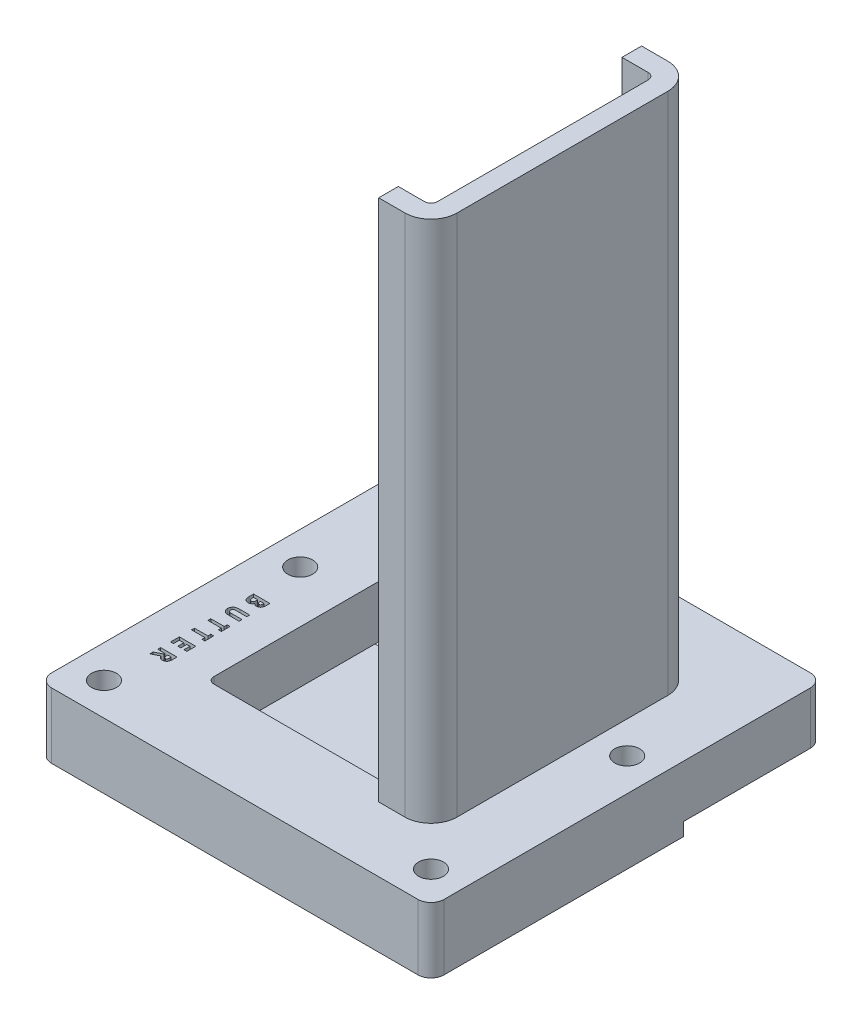
from build123d import *

# Parameters (mm, degrees)
SKETCH1_W           = 76.2
SKETCH1_H           = 76.2
BOSS_EXTRUDE1_DEPTH = 12.7
SKETCH2_W           = 43.434
SKETCH2_H           = 43.434
CUT_EXTRUDE1_DEPTH  = 10.16
FILLET1_R           = 1.27
CUT_EXTRUDE2_DEPTH  = 55.831064188
SKETCH4_R           = 2.413
CUT_EXTRUDE3_DEPTH  = 56.358016583
FILLET2_R           = 2.54
SKETCH5_W           = 76.2
SKETCH5_H           = 27.178
CUT_EXTRUDE4_DEPTH  = 2.54
BOSS_EXTRUDE2_DEPTH = 101.6
CUT_EXTRUDE5_DEPTH  = 1.27


with BuildPart() as part:
    # Sketch1 → Boss-Extrude1 (new body)
    with BuildSketch(Plane(origin=(0, 0, 0), x_dir=(1, 0, 0), z_dir=(0, 1, 0))):
        Rectangle(SKETCH1_W, SKETCH1_H)
    extrude(amount=BOSS_EXTRUDE1_DEPTH)

    # Sketch2 → Cut-Extrude1 (cut)
    with BuildSketch(Plane(origin=(0, 12.7, 0), x_dir=(1, 0, 0), z_dir=(0, 1, 0))):
        Rectangle(SKETCH2_W, SKETCH2_H)
    extrude(amount=-CUT_EXTRUDE1_DEPTH, mode=Mode.SUBTRACT)

    # Fillet1
    fillet1_edges = [part.edges().sort_by_distance(p)[0] for p in [
        (21.717, 7.62, -21.717),
        (21.717, 7.62, 21.717),
        (-21.717, 7.62, 21.717),
        (-21.717, 7.62, -21.717),
    ]]
    fillet(fillet1_edges, radius=FILLET1_R)

    # Sketch3 → Cut-Extrude2 (cut, through all)
    with BuildSketch(Plane(origin=(0, 2.54, 0), x_dir=(1, 0, 0), z_dir=(0, 1, 0))):
        with BuildLine():
            Line((-21.717, 10.8585), (21.717, 10.8585))
            Line((21.717, 10.8585), (21.717, 20.447))
            ThreePointArc((21.717, 20.447), (21.345025612, 21.345025612), (20.447, 21.717))
            Line((20.447, 21.717), (-20.447, 21.717))
            ThreePointArc((-20.447, 21.717), (-21.345025612, 21.345025612), (-21.717, 20.447))
            Line((-21.717, 20.447), (-21.717, 10.8585))
        make_face()
    extrude(amount=-CUT_EXTRUDE2_DEPTH, mode=Mode.SUBTRACT)

    # Sketch4 → Cut-Extrude3 (cut, through all)
    with BuildSketch(Plane(origin=(0, 12.7, 0), x_dir=(1, 0, 0), z_dir=(0, 1, 0))):
        with Locations(Location((31.75, -31.75, 0), (0, 0, 270))):
            Circle(SKETCH4_R)
        with Locations(Location((-31.75, -31.75, 0), (0, 0, 270))):
            Circle(SKETCH4_R)
        with Locations(Location((-31.75, 6.35, 0), (0, 0, 270))):
            Circle(SKETCH4_R)
        with Locations(Location((31.75, 6.35, 0), (0, 0, 270))):
            Circle(SKETCH4_R)
    extrude(amount=-CUT_EXTRUDE3_DEPTH, mode=Mode.SUBTRACT)

    # Fillet2
    fillet2_edges = [part.edges().sort_by_distance(p)[0] for p in [
        (38.1, 6.35, 38.1),
        (-38.1, 6.35, 38.1),
        (-38.1, 6.35, -38.1),
        (38.1, 6.35, -38.1),
    ]]
    fillet(fillet2_edges, radius=FILLET2_R)

    # Sketch5 → Cut-Extrude4 (cut)
    with BuildSketch(Plane.XZ):
        with Locations((0, -24.511)):
            Rectangle(SKETCH5_W, SKETCH5_H)
    extrude(amount=-CUT_EXTRUDE4_DEPTH, mode=Mode.SUBTRACT)

    # Sketch6 → Boss-Extrude2 (add)
    with BuildSketch(Plane(origin=(0, 12.7, 0), x_dir=(1, 0, 0), z_dir=(0, 1, 0))):
        with BuildLine():
            Line((21.717, 20.447), (21.717, -20.447))
            ThreePointArc((21.717, -20.447), (21.345025612, -21.345025612), (20.447, -21.717))
            Line((20.447, -21.717), (15.367, -21.717))
            Line((15.367, -21.717), (15.367, -25.527))
            Line((15.367, -25.527), (20.447, -25.527))
            ThreePointArc((20.447, -25.527), (24.039102448, -24.039102448), (25.527, -20.447))
            Line((25.527, -20.447), (25.527, 20.447))
            ThreePointArc((25.527, 20.447), (24.039102448, 24.039102448), (20.447, 25.527))
            Line((20.447, 25.527), (15.367, 25.527))
            Line((15.367, 25.527), (15.367, 21.717))
            Line((15.367, 21.717), (20.447, 21.717))
            ThreePointArc((20.447, 21.717), (21.345025612, 21.345025612), (21.717, 20.447))
        make_face()
    extrude(amount=BOSS_EXTRUDE2_DEPTH)

    # Sketch7 → Cut-Extrude5 (cut)
    # profile 1 of 6: a face of its own
    with BuildSketch(Plane(origin=(0, 12.7, 0), x_dir=(1, 0, 0), z_dir=(0, 1, 0))):
        with BuildLine():
            Line((-31.75, -2.706891026), (-28.575, -2.706891026))
            Line((-28.575, -2.706891026), (-28.575, -3.215705128))
            add(Edge.make_bspline(
                [(-28.575, -3.215705128), (-28.574995137, -3.25132536), (-28.574985728, -3.320249834), (-28.578488433, -3.419688833), (-28.582959359, -3.511702507), (-28.588129272, -3.596403144), (-28.596709355, -3.67375939), (-28.605943146, -3.743824519), (-28.617004958, -3.806339033), (-28.626934161, -3.844987888), (-28.631605569, -3.863171074)],
                knots=[0, 0, 0, 0, 1.311970222, 2.538637508, 3.664491357, 4.705491327, 5.663608299, 6.530571107, 7.308675535, 8, 8, 8, 8], degree=3))
            add(Edge.make_bspline(
                [(-28.631605569, -3.863171074), (-28.638194181, -3.88704749), (-28.651123154, -3.933900683), (-28.677233774, -4.001009404), (-28.706257574, -4.0646714), (-28.73936832, -4.124808883), (-28.77696567, -4.181052796), (-28.819348304, -4.233188614), (-28.864813897, -4.282343683), (-28.914633644, -4.326761936), (-28.96726547, -4.366939351), (-29.022750818, -4.401734703), (-29.079969611, -4.432340058), (-29.140512041, -4.455369561), (-29.202595768, -4.474906502), (-29.267412722, -4.487944616), (-29.334375665, -4.496701764), (-29.379957183, -4.497507609), (-29.403094952, -4.497916667)],
                knots=[0, 0, 0, 0, 1.100049564, 2.158650393, 3.19569197, 4.207782684, 5.205964631, 6.197678567, 7.190868236, 8.178276592, 9.160005218, 10.129725592, 11.086313322, 12.038063661, 13.003656181, 13.975570909, 14.972373567, 16, 16, 16, 16], degree=3))
            add(Edge.make_bspline(
                [(-29.403094952, -4.497916667), (-29.432835441, -4.496920912), (-29.49141106, -4.494959717), (-29.577073839, -4.479995936), (-29.658577864, -4.455602381), (-29.73669972, -4.421969097), (-29.810544154, -4.375492115), (-29.882422146, -4.318562067), (-29.95107967, -4.248551698), (-29.993155997, -4.195783764), (-30.01494391, -4.168459535)],
                knots=[0, 0, 0, 0, 0.986407369, 1.942786526, 2.875274694, 3.804493715, 4.755190668, 5.761487834, 6.840856292, 8, 8, 8, 8], degree=3))
            add(Edge.make_bspline(
                [(-30.01494391, -4.168459535), (-30.026370228, -4.190846022), (-30.048774075, -4.234739728), (-30.085620165, -4.297036687), (-30.124731949, -4.35478905), (-30.165771887, -4.408045412), (-30.20903962, -4.456619775), (-30.254739664, -4.500196337), (-30.302081807, -4.539684002), (-30.352030701, -4.574141139), (-30.403986777, -4.60418255), (-30.458038313, -4.630561252), (-30.514953603, -4.651688527), (-30.573526028, -4.67064432), (-30.63462587, -4.684535271), (-30.698039927, -4.693658416), (-30.763596511, -4.700623272), (-30.808250316, -4.701166237), (-30.830954527, -4.701442308)],
                knots=[0, 0, 0, 0, 1.164429111, 2.283123328, 3.351198946, 4.394593803, 5.396418104, 6.362192797, 7.318124689, 8.250082273, 9.170054441, 10.097132361, 11.033068162, 11.98068568, 12.948207481, 13.931853282, 14.948451517, 16, 16, 16, 16], degree=3))
            add(Edge.make_bspline(
                [(-30.830954527, -4.701442308), (-30.874339802, -4.699741823), (-30.960003613, -4.696384233), (-31.085314243, -4.669281971), (-31.204827695, -4.625788412), (-31.316782285, -4.565386518), (-31.418692817, -4.49142194), (-31.507971022, -4.406281948), (-31.583294163, -4.310996156), (-31.634586234, -4.223408783), (-31.668842617, -4.147287088), (-31.689734797, -4.083953512), (-31.709489995, -4.01609823), (-31.723224361, -3.942489338), (-31.735830596, -3.864324145), (-31.743606247, -3.780824261), (-31.748877993, -3.69215048), (-31.749618436, -3.631245298), (-31.75, -3.599859776)],
                knots=[0, 0, 0, 0, 1.284172735, 2.535586832, 3.779318718, 5.040902998, 6.290803364, 7.498985797, 8.683813694, 9.877248624, 10.495775879, 11.153159387, 11.85105243, 12.587577416, 13.36920285, 14.195949141, 15.070340539, 16, 16, 16, 16], degree=3))
            Line((-31.75, -3.599859776), (-31.75, -2.706891026))
        make_face()
        with BuildLine():
            Line((-29.144871795, -3.276762821), (-29.836858974, -3.276762821))
            Line((-29.836858974, -3.276762821), (-29.836858974, -3.428135016))
            add(Edge.make_bspline(
                [(-29.836858974, -3.428135016), (-29.836680389, -3.448708113), (-29.836335641, -3.488423231), (-29.831864126, -3.545783375), (-29.82429169, -3.599133957), (-29.813502171, -3.648404394), (-29.800427976, -3.6938825), (-29.783798851, -3.735029662), (-29.763957704, -3.771979495), (-29.73512373, -3.815515466), (-29.690968049, -3.860360124), (-29.628639114, -3.90051613), (-29.556495621, -3.924050404), (-29.505665171, -3.926684607), (-29.479417067, -3.928044872)],
                knots=[0, 0, 0, 0, 1.06517797, 2.056261606, 2.976983468, 3.853439442, 4.666321732, 5.424739265, 6.146762548, 6.834937974, 8.123729748, 9.372478121, 10.64318598, 12, 12, 12, 12], degree=3))
            add(Edge.make_bspline(
                [(-29.479417067, -3.928044872), (-29.454830111, -3.926956797), (-29.40729222, -3.924853047), (-29.340498132, -3.90114093), (-29.281616618, -3.864200845), (-29.240722697, -3.821249936), (-29.213258203, -3.780284297), (-29.194852948, -3.745047828), (-29.178870784, -3.706159534), (-29.166227856, -3.663309065), (-29.156912529, -3.616651242), (-29.150033735, -3.566311252), (-29.145362277, -3.512176567), (-29.145038796, -3.474786723), (-29.144871795, -3.455483774)],
                knots=[0, 0, 0, 0, 1.347718278, 2.605759128, 3.848562309, 5.143913367, 5.833099089, 6.55846056, 7.327535072, 8.143240922, 9.012654655, 9.943163253, 10.938133758, 12, 12, 12, 12], degree=3))
            Line((-29.144871795, -3.455483774), (-29.144871795, -3.276762821))
        make_face(mode=Mode.SUBTRACT)
        with BuildLine():
            Line((-30.366025641, -3.276762821), (-31.180128205, -3.276762821))
            Line((-31.180128205, -3.276762821), (-31.180128205, -3.440855369))
            add(Edge.make_bspline(
                [(-31.180128205, -3.440855369), (-31.179942869, -3.473296674), (-31.179586538, -3.535669133), (-31.175281205, -3.625017569), (-31.167521602, -3.706257634), (-31.157834363, -3.779174074), (-31.144709669, -3.843878572), (-31.128023303, -3.900152413), (-31.109665394, -3.94876732), (-31.086991196, -3.989431795), (-31.060604053, -4.022652341), (-31.033635758, -4.0526304), (-31.002525283, -4.077072642), (-30.968608113, -4.0964118), (-30.932726775, -4.113149808), (-30.893480117, -4.123244991), (-30.852031314, -4.13093111), (-30.823362074, -4.131354098), (-30.80869391, -4.131570513)],
                knots=[0, 0, 0, 0, 1.753078804, 3.370512758, 4.83203934, 6.162291463, 7.344201807, 8.395507345, 9.331626367, 10.147333109, 10.898971645, 11.62040215, 12.321813352, 13.025280112, 13.727906689, 14.453419512, 15.208716525, 16, 16, 16, 16], degree=3))
            add(Edge.make_bspline(
                [(-30.80869391, -4.131570513), (-30.791920582, -4.131093307), (-30.759250652, -4.130163837), (-30.711500929, -4.122571333), (-30.6669201, -4.108777133), (-30.624383761, -4.091390037), (-30.585357893, -4.067242966), (-30.548829295, -4.038462466), (-30.515045041, -4.004396102), (-30.483428477, -3.965292779), (-30.455259373, -3.919671224), (-30.431385351, -3.867216852), (-30.410945456, -3.808232772), (-30.394875089, -3.74235852), (-30.381187317, -3.6698151), (-30.373025869, -3.590038218), (-30.366951763, -3.503702816), (-30.366341363, -3.443835976), (-30.366025641, -3.412870593)],
                knots=[0, 0, 0, 0, 0.845111017, 1.646048916, 2.426852818, 3.192823673, 3.955059885, 4.730950947, 5.531746316, 6.367690631, 7.260101904, 8.225682546, 9.266364501, 10.401326884, 11.639786486, 12.983626756, 14.439818205, 16, 16, 16, 16], degree=3))
            Line((-30.366025641, -3.412870593), (-30.366025641, -3.276762821))
        make_face(mode=Mode.SUBTRACT)
    # profile 2 of 6: a face of its own
    with BuildSketch(Plane(origin=(0, 12.7, 0), x_dir=(1, 0, 0), z_dir=(0, 1, 0))):
        with BuildLine():
            Line((-28.575, -6.614583333), (-28.575, -7.184455128))
            Line((-28.575, -7.184455128), (-30.640785256, -7.184455128))
            add(Edge.make_bspline(
                [(-30.640785256, -7.184455128), (-30.662202422, -7.184486115), (-30.703569456, -7.184545966), (-30.762917606, -7.187542124), (-30.817470982, -7.190283815), (-30.86716986, -7.195230604), (-30.912035499, -7.202538708), (-30.9523561, -7.209615337), (-30.987409768, -7.219192854), (-31.02731002, -7.233586331), (-31.072140132, -7.255761954), (-31.118863104, -7.291995692), (-31.161504597, -7.333806326), (-31.19699776, -7.383918779), (-31.22570853, -7.440240744), (-31.246980033, -7.502462758), (-31.258804165, -7.570497108), (-31.260609335, -7.61753913), (-31.261538462, -7.641751803)],
                knots=[0, 0, 0, 0, 1.155499968, 2.231836252, 3.205919964, 4.102923608, 4.924856345, 5.658536265, 6.31071849, 6.882491295, 7.94666036, 8.992281882, 10.060072772, 11.158554251, 12.289267114, 13.461410017, 14.693379945, 16, 16, 16, 16], degree=3))
            add(Edge.make_bspline(
                [(-31.261538462, -7.641751803), (-31.26079594, -7.66747782), (-31.259348149, -7.717639198), (-31.24483015, -7.789934944), (-31.222251333, -7.857103795), (-31.189368132, -7.917310567), (-31.150550649, -7.970772498), (-31.105226481, -8.015126958), (-31.055712002, -8.051656167), (-31.009093163, -8.07461824), (-30.966592712, -8.08793867), (-30.92829166, -8.096657116), (-30.883479502, -8.104159668), (-30.832354731, -8.110548194), (-30.774586014, -8.114490335), (-30.710590154, -8.11871526), (-30.639944343, -8.120271216), (-30.590751637, -8.120535343), (-30.565099159, -8.120673077)],
                knots=[0, 0, 0, 0, 1.260838023, 2.458420682, 3.603291091, 4.724957099, 5.81103668, 6.833527554, 7.823976978, 8.819602765, 9.36572267, 10.006654001, 10.745469399, 11.594489782, 12.533565386, 13.586096035, 14.741223574, 16, 16, 16, 16], degree=3))
            Line((-30.565099159, -8.120673077), (-28.575, -8.120673077))
            Line((-28.575, -8.120673077), (-28.575, -8.690544872))
            Line((-28.575, -8.690544872), (-30.469060497, -8.690544872))
            add(Edge.make_bspline(
                [(-30.469060497, -8.690544872), (-30.507434781, -8.690475977), (-30.581224787, -8.6903435), (-30.687254913, -8.687871602), (-30.784148949, -8.683343368), (-30.871731269, -8.677722398), (-30.950252067, -8.670981725), (-31.019671284, -8.66225812), (-31.079951709, -8.651586688), (-31.148565593, -8.635593155), (-31.227574304, -8.608029883), (-31.318548604, -8.563579641), (-31.407617534, -8.507156436), (-31.493804373, -8.440467448), (-31.573858845, -8.365164255), (-31.644173435, -8.282940918), (-31.703412889, -8.195171569), (-31.750927405, -8.101141084), (-31.787643501, -8.000178014), (-31.812196692, -7.891572999), (-31.828993762, -7.775623335), (-31.830588612, -7.695665363), (-31.831410256, -7.654472155)],
                knots=[0, 0, 0, 0, 1.170789758, 2.251314523, 3.23554622, 4.130075238, 4.928857907, 5.639700176, 6.263954887, 6.795817153, 7.787924184, 8.809125334, 9.87873356, 10.999178519, 12.129364722, 13.22595565, 14.293390689, 15.352147651, 16.432536881, 17.562186165, 18.74407303, 20, 20, 20, 20], degree=3))
            add(Edge.make_bspline(
                [(-31.831410256, -7.654472155), (-31.830949212, -7.627103217), (-31.830039582, -7.573104861), (-31.822020604, -7.493690377), (-31.810199982, -7.416922325), (-31.792968165, -7.34293728), (-31.770661146, -7.271506422), (-31.743442466, -7.202723172), (-31.710672885, -7.137028684), (-31.673823489, -7.07419229), (-31.633431871, -7.014533555), (-31.589400523, -6.959449036), (-31.543617134, -6.90816718), (-31.495135156, -6.861610432), (-31.444135741, -6.819478272), (-31.390560017, -6.781812535), (-31.334397873, -6.748680969), (-31.274640936, -6.719247034), (-31.20825091, -6.694054619), (-31.132866573, -6.67281642), (-31.047306262, -6.654262244), (-30.951377241, -6.640473871), (-30.845395674, -6.627973253), (-30.729085464, -6.620061051), (-30.602443274, -6.615921822), (-30.514644869, -6.61504077), (-30.469060497, -6.614583333)],
                knots=[0, 0, 0, 0, 1.001195678, 1.975338534, 2.91783225, 3.841754112, 4.752027347, 5.653798756, 6.545402703, 7.435486725, 8.317659034, 9.179053568, 10.013983148, 10.831468265, 11.636005169, 12.432309474, 13.225243684, 14.019732185, 14.86686161, 15.819485008, 16.883051984, 18.067941734, 19.364090787, 20.787286826, 22.331979793, 24, 24, 24, 24], degree=3))
            Line((-30.469060497, -6.614583333), (-28.575, -6.614583333))
        make_face()
    # profile 3 of 6: a face of its own
    with BuildSketch(Plane(origin=(0, 12.7, 0), x_dir=(1, 0, 0), z_dir=(0, 1, 0))):
        Polygon((-28.575, -10.440865385), (-28.575, -12.150480769), (-29.144871795, -12.150480769), (-29.144871795, -11.580608974), (-31.75, -11.580608974), (-31.75, -11.010737179), (-29.144871795, -11.010737179), (-29.144871795, -10.440865385), align=None)
    # profile 4 of 6: a face of its own
    with BuildSketch(Plane(origin=(0, 12.7, 0), x_dir=(1, 0, 0), z_dir=(0, 1, 0))):
        Polygon((-28.575, -13.615865385), (-28.575, -15.325480769), (-29.144871795, -15.325480769), (-29.144871795, -14.755608974), (-31.75, -14.755608974), (-31.75, -14.185737179), (-29.144871795, -14.185737179), (-29.144871795, -13.615865385), align=None)
    # profile 5 of 6: a face of its own
    with BuildSketch(Plane(origin=(0, 12.7, 0), x_dir=(1, 0, 0), z_dir=(0, 1, 0))):
        Polygon((-28.575, -17.11650641), (-28.575, -18.826121795), (-29.144871795, -18.826121795), (-29.144871795, -17.686378205), (-29.755448718, -17.686378205), (-29.755448718, -18.826121795), (-30.325320513, -18.826121795), (-30.325320513, -17.686378205), (-31.180128205, -17.686378205), (-31.180128205, -18.826121795), (-31.75, -18.826121795), (-31.75, -17.11650641), align=None)
    # profile 6 of 6: a face of its own
    with BuildSketch(Plane(origin=(0, 12.7, 0), x_dir=(1, 0, 0), z_dir=(0, 1, 0))):
        with BuildLine():
            Line((-28.575, -20.739262821), (-28.575, -21.403265224))
            add(Edge.make_bspline(
                [(-28.575, -21.403265224), (-28.575155307, -21.447155651), (-28.575454007, -21.531569306), (-28.580187542, -21.65328806), (-28.58674457, -21.765107452), (-28.596873334, -21.867384534), (-28.609971029, -21.959714643), (-28.625861196, -22.042293335), (-28.643812761, -22.115168562), (-28.665815187, -22.179324556), (-28.691153419, -22.237062434), (-28.719752993, -22.290731554), (-28.752694594, -22.341277952), (-28.788643444, -22.389629397), (-28.828887102, -22.434922839), (-28.873099442, -22.477032782), (-28.920961781, -22.516500689), (-28.972186312, -22.553378788), (-29.026701524, -22.586196084), (-29.083733346, -22.615270589), (-29.143435891, -22.639158026), (-29.205467376, -22.659047859), (-29.269902394, -22.67436182), (-29.33669911, -22.684759433), (-29.40588592, -22.692447516), (-29.45289378, -22.692885536), (-29.476872997, -22.693108974)],
                knots=[0, 0, 0, 0, 1.749037589, 3.363891962, 4.853828513, 6.212420965, 7.458679178, 8.568887289, 9.562757098, 10.447168552, 11.268163578, 12.073310924, 12.867792413, 13.67045336, 14.472446998, 15.279188696, 16.101356728, 16.943088626, 17.792208908, 18.634830833, 19.491484118, 20.351879174, 21.228996054, 22.12769993, 23.044919519, 24, 24, 24, 24], degree=3))
            add(Edge.make_bspline(
                [(-29.476872997, -22.693108974), (-29.501901303, -22.692524809), (-29.550977249, -22.691379366), (-29.623065812, -22.68520939), (-29.692035106, -22.673932612), (-29.757683199, -22.656852291), (-29.820827157, -22.63722068), (-29.880301934, -22.611115673), (-29.936972505, -22.581653593), (-29.990037244, -22.546662342), (-30.040674824, -22.508261153), (-30.086945132, -22.463601378), (-30.131335022, -22.415576284), (-30.171064061, -22.361486206), (-30.208818583, -22.303715485), (-30.243034235, -22.241116278), (-30.274571119, -22.174097127), (-30.292158263, -22.126979346), (-30.301151843, -22.102884615)],
                knots=[0, 0, 0, 0, 1.099860209, 2.156625411, 3.176576793, 4.16617041, 5.135385252, 6.078461593, 7.016046972, 7.938469504, 8.868247731, 9.803980173, 10.76021508, 11.73834243, 12.748633912, 13.790971185, 14.870363756, 16, 16, 16, 16], degree=3))
            Line((-30.301151843, -22.102884615), (-31.75, -22.835576923))
            Line((-31.75, -22.835576923), (-31.75, -22.202103365))
            Line((-31.75, -22.202103365), (-30.366025641, -21.502483974))
            Line((-30.366025641, -21.502483974), (-30.366025641, -21.309134615))
            Line((-30.366025641, -21.309134615), (-31.75, -21.309134615))
            Line((-31.75, -21.309134615), (-31.75, -20.739262821))
            Line((-31.75, -20.739262821), (-28.575, -20.739262821))
        make_face()
        with BuildLine():
            Line((-29.796153846, -21.309134615), (-29.796153846, -21.531104768))
            add(Edge.make_bspline(
                [(-29.796153846, -21.531104768), (-29.795848208, -21.558242468), (-29.795262976, -21.610205334), (-29.792548329, -21.68493469), (-29.786007705, -21.752807009), (-29.777743006, -21.814112712), (-29.768202923, -21.869163641), (-29.754522214, -21.917458062), (-29.739889692, -21.959774088), (-29.721618104, -21.995504147), (-29.70120474, -22.026155664), (-29.676991472, -22.051847897), (-29.650467122, -22.074481829), (-29.619962233, -22.092236082), (-29.586726585, -22.106580374), (-29.550134881, -22.115476241), (-29.510849658, -22.122534268), (-29.48348222, -22.122996595), (-29.469240785, -22.123237179)],
                knots=[0, 0, 0, 0, 1.688935225, 3.233948049, 4.651771667, 5.929878493, 7.083962697, 8.124219224, 9.050753627, 9.864999381, 10.615157594, 11.334035464, 12.05533055, 12.777108108, 13.522027315, 14.29964284, 15.115170198, 16, 16, 16, 16], degree=3))
            add(Edge.make_bspline(
                [(-29.469240785, -22.123237179), (-29.452414053, -22.122590814), (-29.419361056, -22.121321148), (-29.371776984, -22.108721421), (-29.32773214, -22.088666944), (-29.287437854, -22.061172056), (-29.252076669, -22.026567143), (-29.22115928, -21.986922388), (-29.19614174, -21.941652943), (-29.180119267, -21.899438446), (-29.170270819, -21.860765068), (-29.163279693, -21.825977024), (-29.157859049, -21.785582808), (-29.152611467, -21.739807817), (-29.148999424, -21.688455198), (-29.146443719, -21.631619793), (-29.14538327, -21.56926948), (-29.145047196, -21.525804702), (-29.144871795, -21.503119992)],
                knots=[0, 0, 0, 0, 1.020213939, 2.004021227, 2.966357326, 3.948562114, 4.950324333, 5.960000531, 6.991850424, 8.080015304, 8.69218159, 9.414443227, 10.233931419, 11.166782034, 12.212677862, 13.359889063, 14.622099264, 16, 16, 16, 16], degree=3))
            Line((-29.144871795, -21.503119992), (-29.144871795, -21.309134615))
            Line((-29.144871795, -21.309134615), (-29.796153846, -21.309134615))
        make_face(mode=Mode.SUBTRACT)
    extrude(amount=-CUT_EXTRUDE5_DEPTH, mode=Mode.SUBTRACT)


solid = part.part
